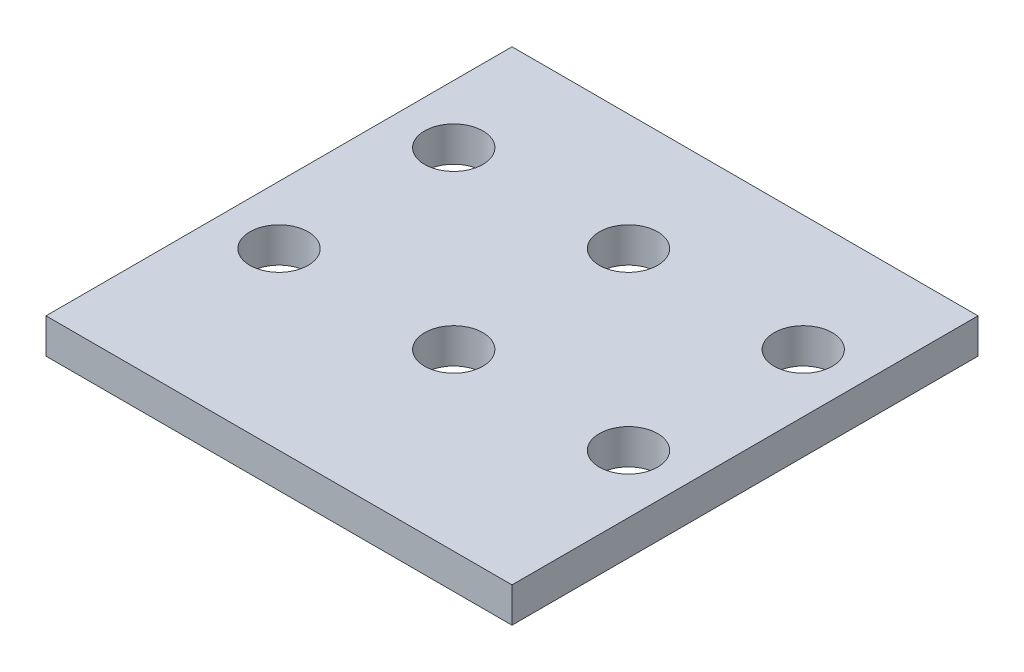
from build123d import *

# Parameters (mm, degrees)
SKETCH1_W            = 50.8
SKETCH1_H            = 50.8
BOSS_EXTRUDE1_DEPTH  = 3.81
SKETCH2_R            = 3.175
CUT_EXTRUDE1_DEPTH   = 37.122515139
LPATTERN1_COUNT      = 2
LPATTERN1_PITCH      = 19.05
LPATTERN1_COUNT_DIR2 = 3
LPATTERN1_PITCH_DIR2 = 19.05


with BuildPart() as part:
    # Sketch1 → Boss-Extrude1 (new body)
    with BuildSketch(Plane(origin=(0, 0, 0), x_dir=(1, 0, 0), z_dir=(0, 1, 0))):
        Rectangle(SKETCH1_W, SKETCH1_H)
    extrude(amount=BOSS_EXTRUDE1_DEPTH)

    # Sketch2 → Cut-Extrude1 (cut, through all)
    with BuildSketch(Plane(origin=(0, 3.81, 0), x_dir=(1, 0, 0), z_dir=(0, 1, 0))):
        with Locations(Location((-19.05, -6.35, 0), (0, 0, 270))):
            Circle(SKETCH2_R)
    cut_extrude1 = extrude(amount=-CUT_EXTRUDE1_DEPTH, mode=Mode.SUBTRACT)

    # LPattern1: Cut-Extrude1 2 × 3
    with Locations(*[(j * LPATTERN1_PITCH_DIR2, 0, -i * LPATTERN1_PITCH) for i in range(LPATTERN1_COUNT) for j in range(LPATTERN1_COUNT_DIR2) if (i, j) != (0, 0)]):
        add(cut_extrude1, mode=Mode.SUBTRACT)


solid = part.part
